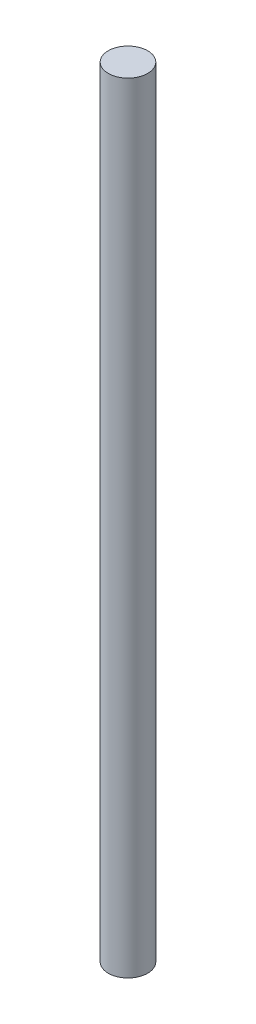
from build123d import *

# Parameters (mm, degrees)
SKETCH1_R           = 1.25
BOSS_EXTRUDE1_DEPTH = 24.75


with BuildPart() as part:
    # Sketch1 → Boss-Extrude1 (new, symmetric)
    with BuildSketch(Plane(origin=(0, 0, 0), x_dir=(1, 0, 0), z_dir=(0, 1, 0))):
        with Locations(Location((0, 0, 0), (0, 0, 270))):
            Circle(SKETCH1_R)
    extrude(amount=BOSS_EXTRUDE1_DEPTH, both=True)


solid = part.part
